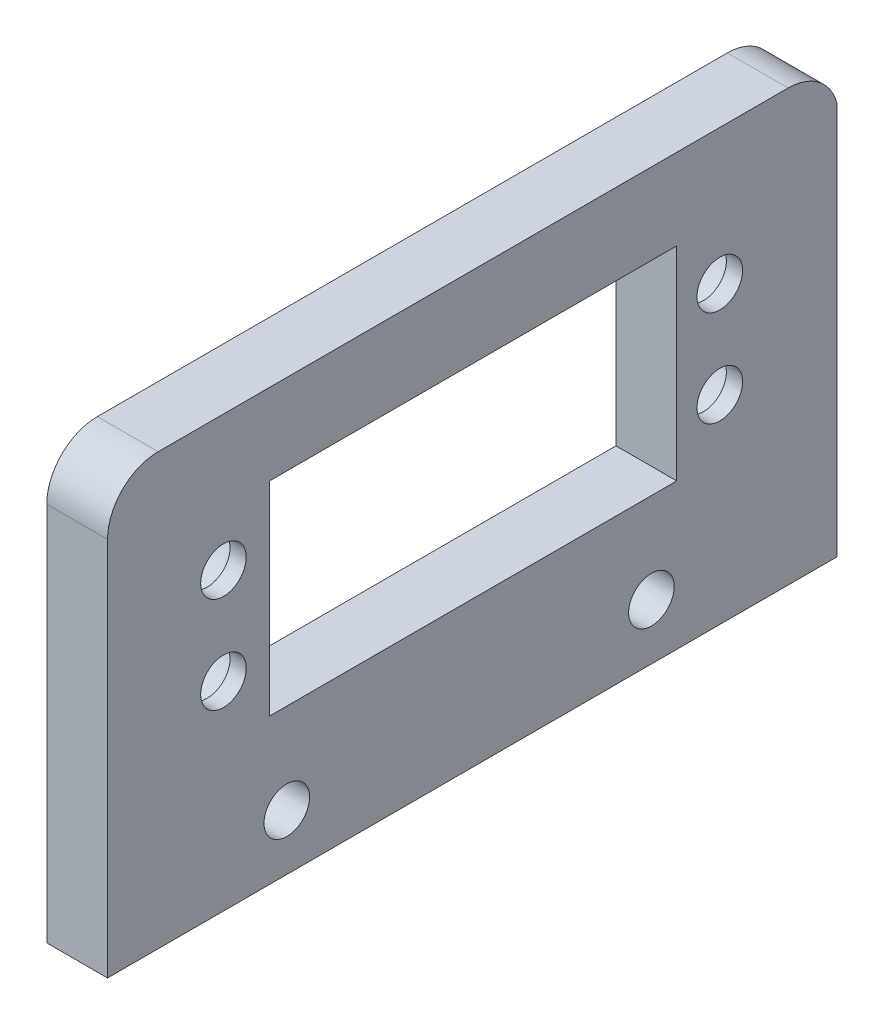
from build123d import *

# Parameters (mm, degrees)
SKETCH1_W                                           = 40.2
SKETCH1_H                                           = 20.1
BOSS_EXTRUDE1_DEPTH                                 = 6
CBORE_FOR_M4_HEX_SOCKET_HEAD_CAP_SCREW1_D           = 4.5
CBORE_FOR_M4_HEX_SOCKET_HEAD_CAP_SCREW1_CBORE_D     = 8
CBORE_FOR_M4_HEX_SOCKET_HEAD_CAP_SCREW1_CBORE_DEPTH = 4.4
M4_CLEARANCE_HOLE1_D                                = 4.5


with BuildPart() as part:
    # Sketch1 → Boss-Extrude1 (new body)
    with BuildSketch(Plane(origin=(0, 0, 0), x_dir=(0, 0, -1), z_dir=(1, 0, 0))):
        with BuildLine():
            Line((-36.096117968, -19.95), (-36.096117968, 17.55))
            ThreePointArc((-36.096117968, 17.55), (-34.631651874, 21.085533906), (-31.096117968, 22.55))
            Line((-31.096117968, 22.55), (31.096117968, 22.55))
            ThreePointArc((31.096117968, 22.55), (34.173179015, 21.49102719), (35.946830469, 18.762678125))
            Line((35.946830469, 18.762678125), (35.946830469, -19.95))
            Line((35.946830469, -19.95), (-36.096117968, -19.95))
        make_face()
        with Locations((0, 4.5)):
            Rectangle(SKETCH1_W, SKETCH1_H, mode=Mode.SUBTRACT)
    extrude(amount=BOSS_EXTRUDE1_DEPTH)

    # CBORE for M4 Hex Socket Head Cap Screw1 (through all)
    with Locations(Plane(origin=(0, -170.712474926, -177.829982134), x_dir=(0, 0, 1), z_dir=(-1, 0, 0))):
        with Locations((202.479982134, 170.412474926), (202.479982134, 179.912474926), (153.479982134, 170.412474926), (153.479982134, 179.912474926)):
            CounterBoreHole(CBORE_FOR_M4_HEX_SOCKET_HEAD_CAP_SCREW1_D / 2, CBORE_FOR_M4_HEX_SOCKET_HEAD_CAP_SCREW1_CBORE_D / 2, CBORE_FOR_M4_HEX_SOCKET_HEAD_CAP_SCREW1_CBORE_DEPTH)

    # M4 Clearance Hole1 (through all)
    with Locations(Plane(origin=(0, -170.712474926, -177.829982134), x_dir=(0, 0, 1), z_dir=(-1, 0, 0))):
        with Locations((160.229982134, 156.262474926), (196.229982134, 156.262474926)):
            Hole(M4_CLEARANCE_HOLE1_D / 2)


solid = part.part
